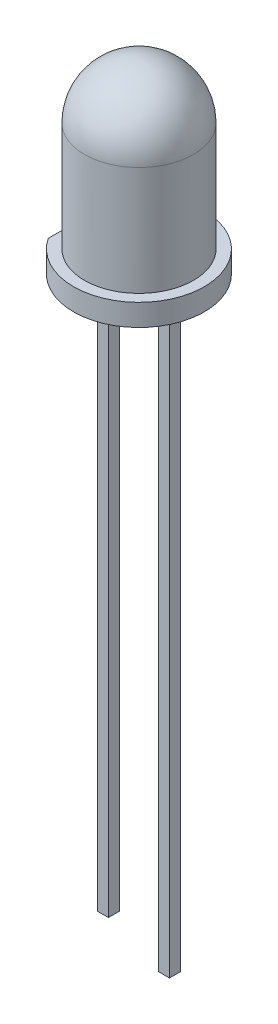
from build123d import *

# Parameters (mm, degrees)
BOSS_EXTRUDE1_DEPTH = 1
SKETCH2_R           = 2.5
BOSS_EXTRUDE2_DEPTH = 7.5
FILLET1_R           = 2.5
SKETCH3_W           = 0.5
SKETCH3_H           = 0.5
BOSS_EXTRUDE3_DEPTH = 26
SKETCH4_W           = 0.5
SKETCH4_H           = 0.5
BOSS_EXTRUDE4_DEPTH = 1


with BuildPart() as part:
    # Sketch1 → Boss-Extrude1 (new body)
    with BuildSketch(Plane(origin=(0, 0, 0), x_dir=(1, 0, 0), z_dir=(0, 1, 0))):
        with BuildLine():
            Line((-2.5, 1.658312395), (-2.5, -1.658312395))
            ThreePointArc((-2.5, -1.658312395), (3, 0), (-2.5, 1.658312395))
        make_face()
    extrude(amount=BOSS_EXTRUDE1_DEPTH)

    # Sketch2 → Boss-Extrude2 (add)
    with BuildSketch(Plane(origin=(0, 1, 0), x_dir=(1, 0, 0), z_dir=(0, 1, 0))):
        with Locations(Location((0, 0, 0), (0, 0, 180))):
            Circle(SKETCH2_R)
    extrude(amount=BOSS_EXTRUDE2_DEPTH)

    # Fillet1
    fillet1_edges = [part.edges().sort_by_distance(p)[0] for p in [
        (2.5, 8.5, 0),
    ]]
    fillet(fillet1_edges, radius=FILLET1_R)

    # Sketch3 → Boss-Extrude3 (add)
    with BuildSketch(Plane(origin=(0, 0, 0), x_dir=(1, 0, 0), z_dir=(0, 1, 0))):
        with Locations((-1.4, 0)):
            Rectangle(SKETCH3_W, SKETCH3_H)
        with Locations((1.4, 0)):
            Rectangle(SKETCH3_W, SKETCH3_H)
    extrude(amount=-BOSS_EXTRUDE3_DEPTH)

    # Sketch4 → Boss-Extrude4 (add)
    with BuildSketch(Plane.XZ.offset(26)):
        with Locations((1.4, 0)):
            Rectangle(SKETCH4_W, SKETCH4_H)
    extrude(amount=BOSS_EXTRUDE4_DEPTH)


solid = part.part
